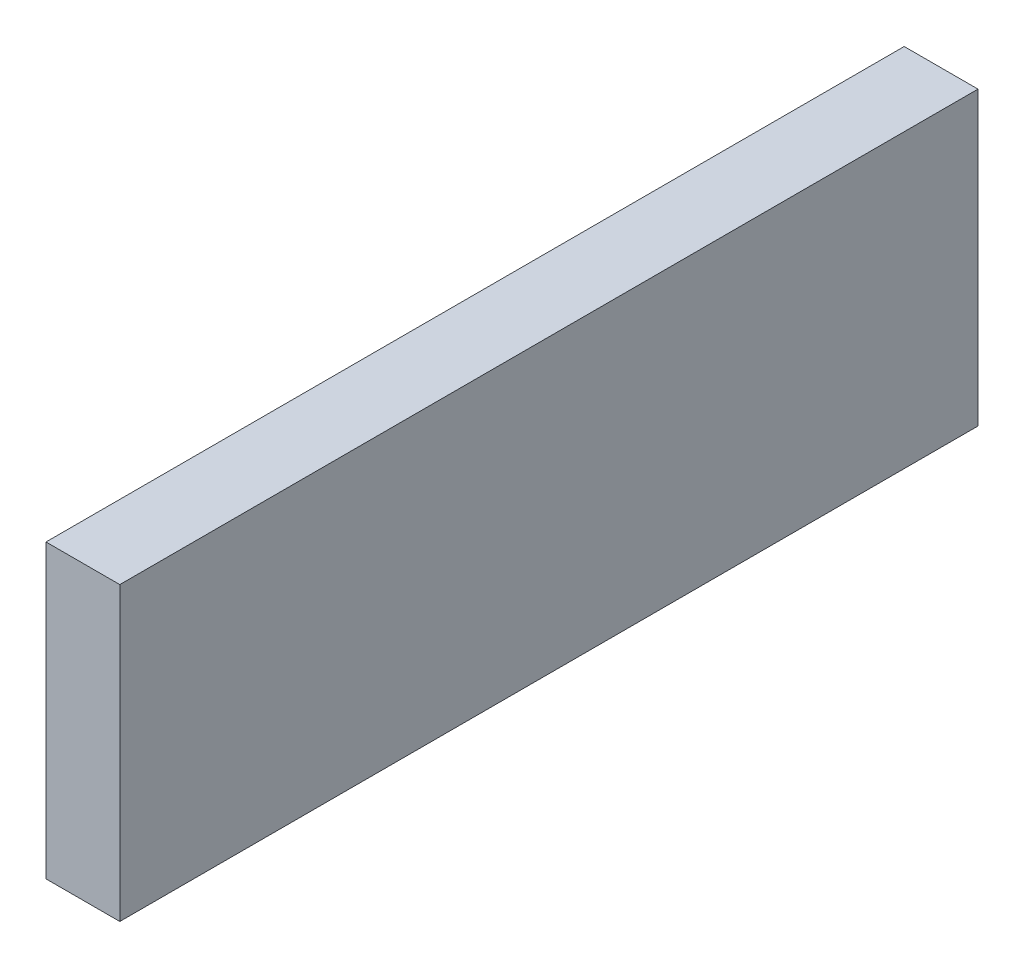
from build123d import *

# Parameters (mm, degrees)
SKETCH1_W           = 127
SKETCH1_H           = 43.18
BOSS_EXTRUDE1_DEPTH = 10.922


with BuildPart() as part:
    # Sketch1 → Boss-Extrude1 (new body)
    with BuildSketch(Plane(origin=(0, 0, 0), x_dir=(0, 0, -1), z_dir=(1, 0, 0))):
        Rectangle(SKETCH1_W, SKETCH1_H)
    extrude(amount=BOSS_EXTRUDE1_DEPTH)


solid = part.part
